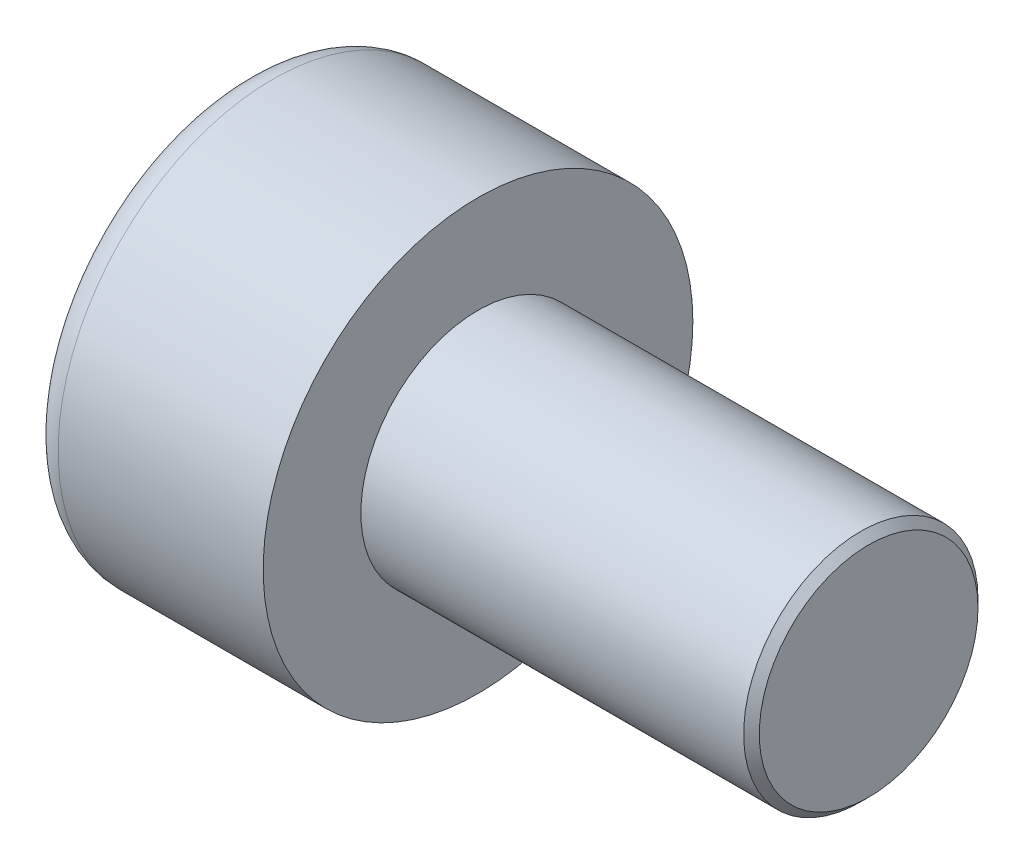
from build123d import *

# Parameters (mm, degrees)
SKETCH1_R           = 2.75
BASEHEAD_DEPTH      = 3
SKETCH2_R           = 1.5
BASEBODY_DEPTH      = 5
HEXAGONSOCKET_DEPTH = 1.3
TOPFILLET_R         = 0.375
CHAMFER1_SIZE       = 0.1


with BuildPart() as part:
    # Sketch1 → BaseHead (new body)
    with BuildSketch(Plane(origin=(0, 0, 0), x_dir=(0, 0, -1), z_dir=(1, 0, 0))):
        Circle(SKETCH1_R)
    extrude(amount=BASEHEAD_DEPTH)

    # Sketch2 → BaseBody (add)
    with BuildSketch(Plane(origin=(3, 0, 0), x_dir=(0, 0, -1), z_dir=(1, 0, 0))):
        Circle(SKETCH2_R)
    extrude(amount=BASEBODY_DEPTH)

    # Sketch3 → HexagonSocket (cut)
    with BuildSketch(Plane(origin=(0, 0, 0), x_dir=(0, 0, -1), z_dir=(1, 0, 0))):
        Polygon((1.443375673, 0), (0.721687836, 1.25), (-0.721687836, 1.25), (-1.443375673, 0), (-0.721687836, -1.25), (0.721687836, -1.25), align=None)
    extrude(amount=HEXAGONSOCKET_DEPTH, mode=Mode.SUBTRACT)

    # Sketch4 → Cut-Revolve1 (revolve, cut)
    with BuildSketch(Plane(origin=(-4.19613823, 0.75, 0), x_dir=(-1, 0, 0), z_dir=(0, 0, 1)), mode=Mode.PRIVATE) as cut_revolve1_sk:
        Polygon((-5.49613823, 2), (-6.217826066, 0.75), (-5.49613823, 0.75), align=None)
    revolve(cut_revolve1_sk.sketch.rotate(Axis((0.838992387, 0, 0), (-1, 0, 0)), 90), axis=Axis((0.838992387, 0, 0), (-1, 0, 0)), mode=Mode.SUBTRACT)

    # TopFillet
    topfillet_edges = [part.edges().sort_by_distance(p)[0] for p in [
        (0, 0, 2.75),
    ]]
    fillet(topfillet_edges, radius=TOPFILLET_R)

    # Chamfer1
    chamfer1_edges = [part.edges().sort_by_distance(p)[0] for p in [
        (8, 0, 1.5),
    ]]
    chamfer(chamfer1_edges, length=CHAMFER1_SIZE)


solid = part.part
